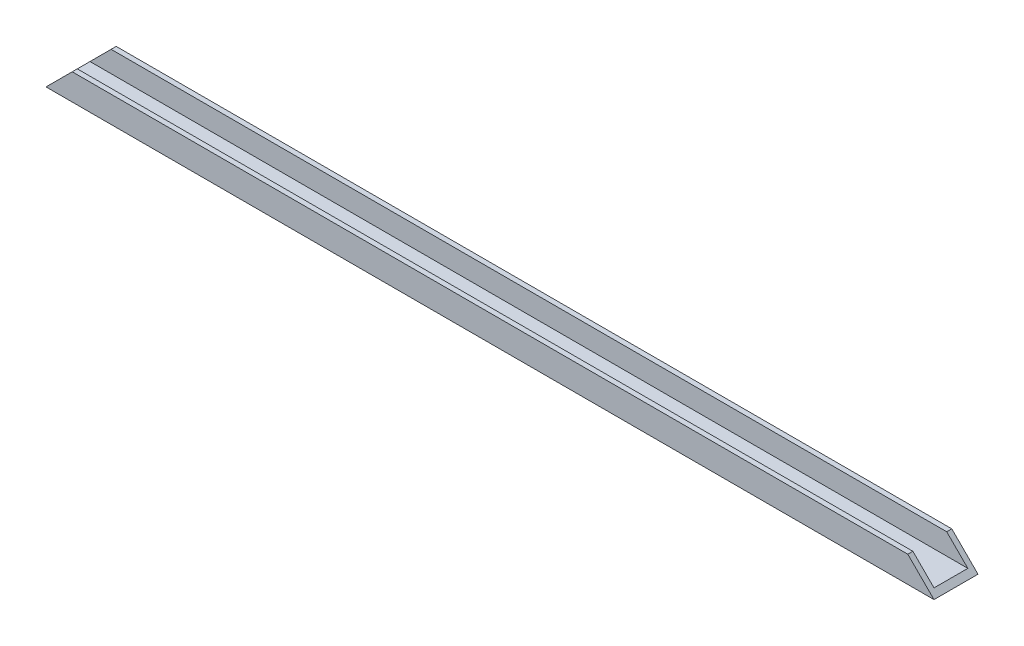
from build123d import *

# Parameters (mm, degrees)
BOSS_EXTRUDE1_DEPTH = 105
CUT_EXTRUDE1_DEPTH  = 106.632192063


with BuildPart() as part:
    # Sketch1 → Boss-Extrude1 (new, symmetric)
    with BuildSketch(Plane(origin=(0, 0, 0), x_dir=(0, 0, -1), z_dir=(1, 0, 0))):
        Polygon((-4, 5), (-4, 0), (4, 0), (4, 5), (5.2, 5), (5.2, -1.2), (-5.2, -1.2), (-5.2, 5), align=None)
    extrude(amount=BOSS_EXTRUDE1_DEPTH, both=True)

    # Sketch3 → Cut-Extrude1 (cut, through all)
    with BuildSketch(Plane.XY.offset(5.2)):
        Polygon((-105, 5), (-105, -1.2), (-98.8, 5), align=None)
        Polygon((105, 5), (105, -1.2), (98.8, 5), align=None)
    extrude(amount=-CUT_EXTRUDE1_DEPTH, mode=Mode.SUBTRACT)


solid = part.part
